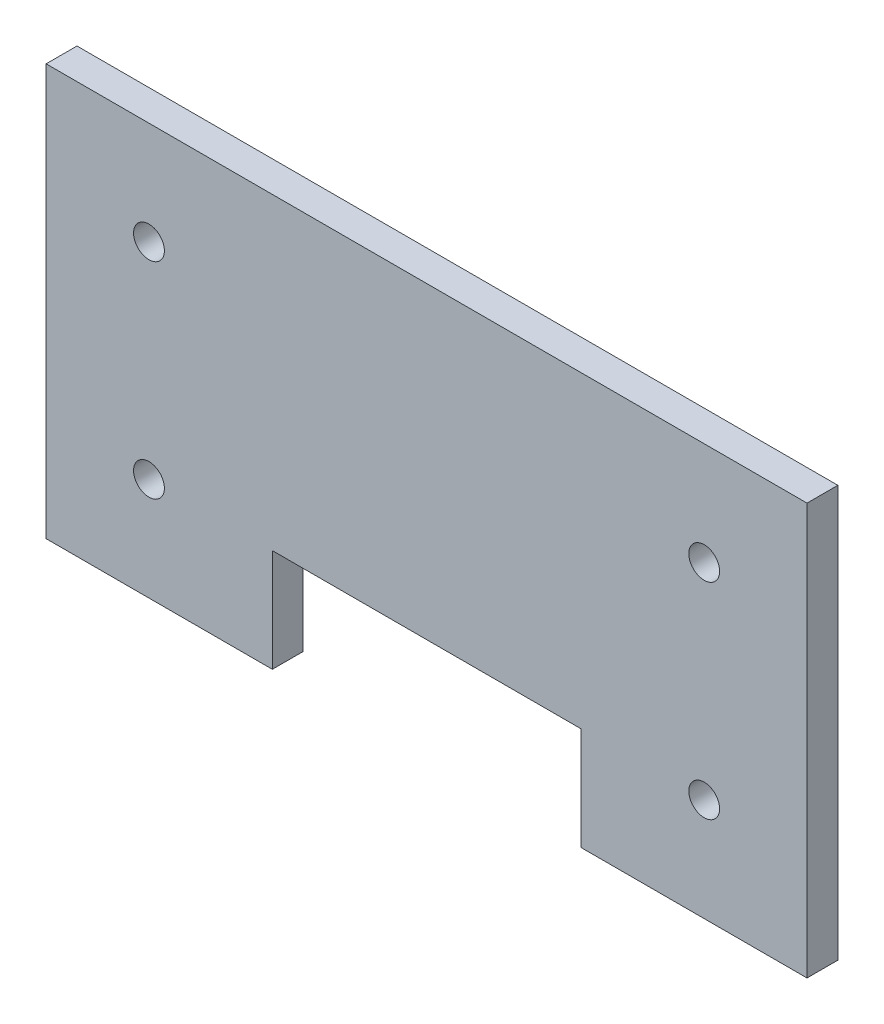
from build123d import *

# Parameters (mm, degrees)
SKETCH_1_R      = 1.5
EXTRUDE_1_DEPTH = 3


with BuildPart() as part:
    # 草图1 → 凸台-拉伸1 (new body)
    with BuildSketch(Plane.XY):
        Polygon((37, 20), (-37, 20), (-37, -20), (-15, -20), (-15, -10), (15, -10), (15, -20), (37, -20), align=None)
        with Locations((-27, -10)):
            Circle(SKETCH_1_R, mode=Mode.SUBTRACT)
        with Locations((27, -10)):
            Circle(SKETCH_1_R, mode=Mode.SUBTRACT)
        with Locations((-27, 10)):
            Circle(SKETCH_1_R, mode=Mode.SUBTRACT)
        with Locations((27, 10)):
            Circle(SKETCH_1_R, mode=Mode.SUBTRACT)
    extrude(amount=EXTRUDE_1_DEPTH)


solid = part.part
